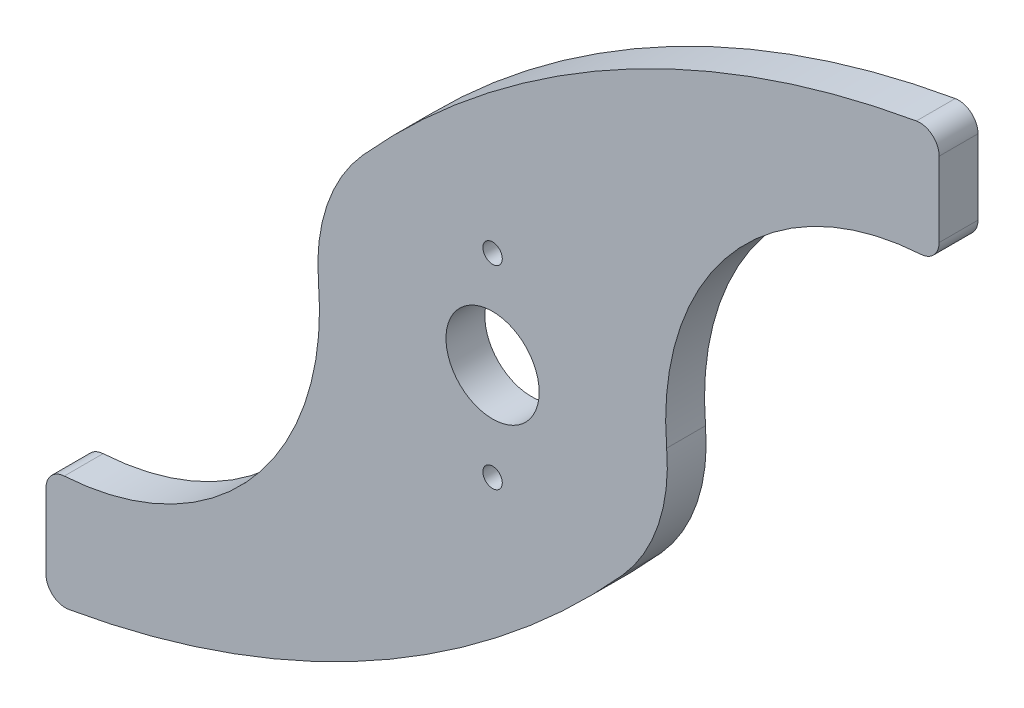
from build123d import *

# Parameters (mm, degrees)
SKETCH1_R           = 45
SKETCH1_R_2         = 12
BOSS_EXTRUDE1_DEPTH = 10
BOSS_EXTRUDE3_START = -10
BOSS_EXTRUDE3_DEPTH = 10
FILLET2_R           = 5
SKETCH3_R           = 2.5
CUT_EXTRUDE1_DEPTH  = 159.845357518


with BuildPart() as part:
    # Sketch1 → Boss-Extrude1 (new body)
    with BuildSketch(Plane.XY):
        Circle(SKETCH1_R)
        Circle(SKETCH1_R_2, mode=Mode.SUBTRACT)
    extrude(amount=BOSS_EXTRUDE1_DEPTH)

    # Sketch2 → Boss-Extrude3 (add)
    with BuildSketch(Plane.XY.offset(10).offset(BOSS_EXTRUDE3_START)):
        with BuildLine():
            ThreePointArc((33.436200174, -30.116781334), (-14.286491123, -42.671960013), (-44.829498519, -3.91357414))
            ThreePointArc((-44.829498519, -3.91357414), (-63.106761283, -57.457908747), (-115, -80))
            Line((-115, -80), (-115, -110))
            ThreePointArc((-115, -110), (-33.84606429, -82.946317595), (33.436200174, -30.116781334))
        make_face()
        with BuildLine():
            Line((115, 80), (115, 110))
            ThreePointArc((115, 110), (33.84606429, 82.946317595), (-33.436200174, 30.116781334))
            ThreePointArc((-33.436200174, 30.116781334), (14.286491123, 42.671960013), (44.829498519, 3.91357414))
            ThreePointArc((44.829498519, 3.91357414), (63.106761283, 57.457908747), (115, 80))
        make_face()
    extrude(amount=BOSS_EXTRUDE3_DEPTH)

    # Fillet2
    fillet2_edges = [part.edges().sort_by_distance(p)[0] for p in [
        (-115, -110, 5),
        (-115, -80, 5),
        (115, 80, 5),
        (115, 110, 5),
    ]]
    fillet(fillet2_edges, radius=FILLET2_R)

    # Sketch3 → Cut-Extrude1 (cut, through all)
    with BuildSketch(Plane.XY.offset(10)):
        with Locations((0, 25)):
            Circle(SKETCH3_R)
        with Locations((0, -25)):
            Circle(SKETCH3_R)
    extrude(amount=-CUT_EXTRUDE1_DEPTH, mode=Mode.SUBTRACT)


solid = part.part
